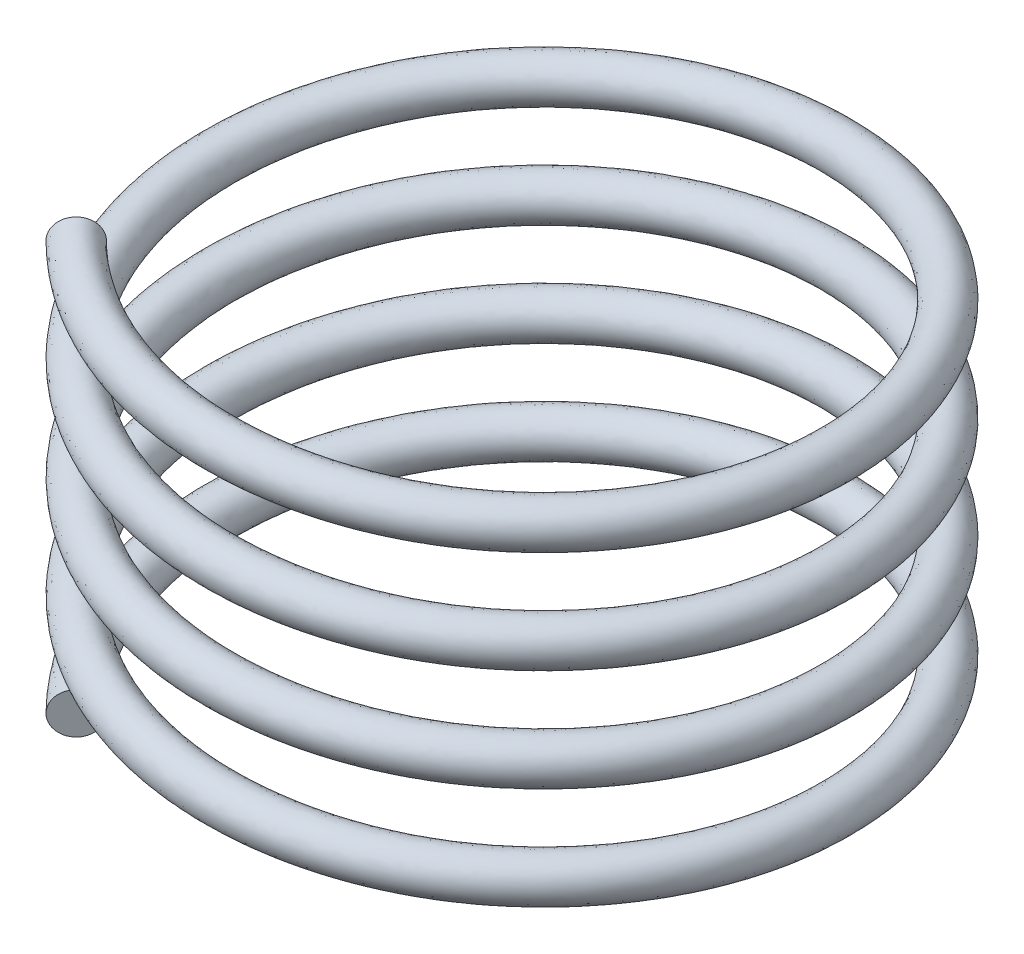
from build123d import *

# Parameters (mm, degrees)
SWEEP1_PITCH       = 1.55575
SWEEP1_HEIGHT      = 6.223
SWEEP1_RADIUS      = 4.675
SWEEP1_START_ANGLE = -45
SKETCH4_R          = 0.325


with BuildPart() as part:
    # Sweep1: sweep along a helix
    with BuildLine() as sweep1_path:
        add(Helix(SWEEP1_PITCH, SWEEP1_HEIGHT, SWEEP1_RADIUS, center=(0, 0, 0), direction=(0, 1, 0), lefthand=True, mode=Mode.PRIVATE).rotate(Axis((0, 0, 0), (0, 1, 0)), SWEEP1_START_ANGLE))
    # Sketch4 → Sweep1 (sweep)
    with BuildSketch(Plane(origin=(-3.305724202, 0, 3.305724202), x_dir=(-0.6997046632768491, 0.10094110133686449, 0.7072653520776571), z_dir=(-0.7061170912955571, 0.052889571378746926, -0.7061170912955402))):
        with Locations((0.00928562, 0.003561064)):
            Circle(SKETCH4_R)
    sweep(path=sweep1_path.line, is_frenet=True)


solid = part.part
